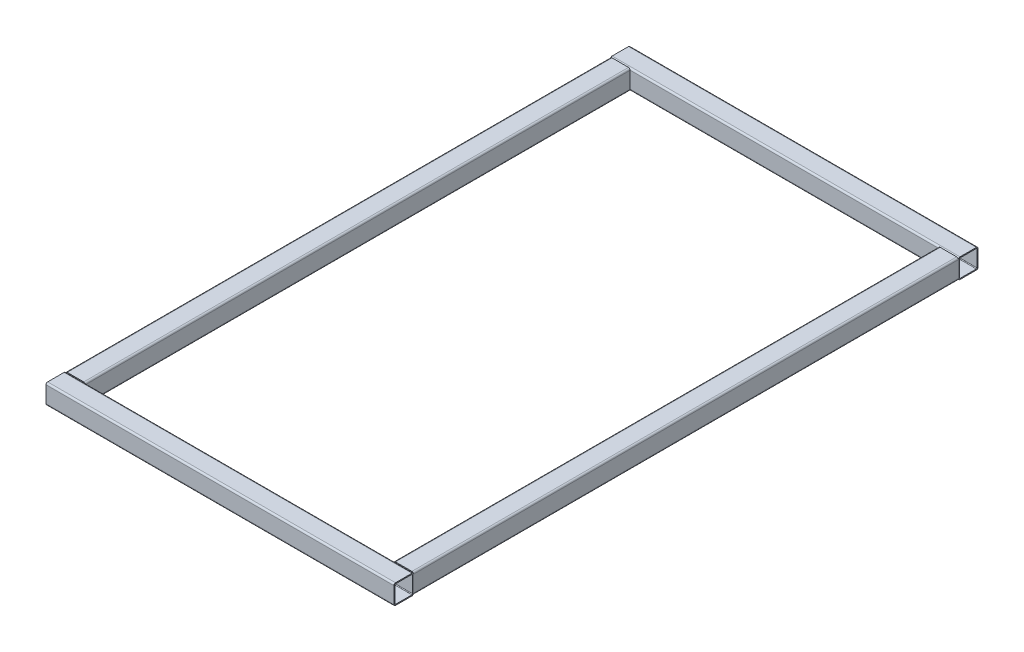
from build123d import *

# Parameters (mm, degrees)
F_120_X_80_X_8_1_DEPTH      = 1030
F_120_X_80_X_8_1_DEPTH_BACK = 30
F_120_X_80_X_8_1_2_DEPTH    = 1060
F_120_X_80_X_8_1_3_DEPTH    = 1722
F_120_X_80_X_8_1_4_DEPTH    = 1722


with BuildPart() as part:
    # Sketch1 → Прямоугольная труба 120 X 80 X 8(1) (new, two sides: drawn at the far end of the back side and taken through both)
    with BuildSketch(Plane(origin=(500, 448, 1720), x_dir=(0, -1, 0), z_dir=(-1, 0, 0)).offset(-F_120_X_80_X_8_1_DEPTH_BACK)):
        with BuildLine():
            Line((-25, -30), (25, -30))
            ThreePointArc((25, -30), (28.535533906, -28.535533906), (30, -25))
            Line((30, -25), (30, 25))
            ThreePointArc((30, 25), (28.535533906, 28.535533906), (25, 30))
            Line((25, 30), (-25, 30))
            ThreePointArc((-25, 30), (-28.535533906, 28.535533906), (-30, 25))
            Line((-30, 25), (-30, -25))
            ThreePointArc((-30, -25), (-28.535533906, -28.535533906), (-25, -30))
        make_face()
        with BuildLine():
            Line((-25, -27), (25, -27))
            ThreePointArc((25, -27), (26.414213562, -26.414213562), (27, -25))
            Line((27, -25), (27, 25))
            ThreePointArc((27, 25), (26.414213562, 26.414213562), (25, 27))
            Line((25, 27), (-25, 27))
            ThreePointArc((-25, 27), (-26.414213562, 26.414213562), (-27, 25))
            Line((-27, 25), (-27, -25))
            ThreePointArc((-27, -25), (-26.414213562, -26.414213562), (-25, -27))
        make_face(mode=Mode.SUBTRACT)
    extrude(amount=F_120_X_80_X_8_1_DEPTH + F_120_X_80_X_8_1_DEPTH_BACK)


with BuildPart() as body_2:
    # Sketch1 on segment 2 (carried to segment 2) → 120 X 80 X 8_1 2 (new body)
    with BuildSketch(Plane(origin=(530, 448, 0), x_dir=(0, -1, 0), z_dir=(-1, 0, 0))):
        with BuildLine():
            Line((-25, -30), (25, -30))
            ThreePointArc((25, -30), (28.535533906, -28.535533906), (30, -25))
            Line((30, -25), (30, 25))
            ThreePointArc((30, 25), (28.535533906, 28.535533906), (25, 30))
            Line((25, 30), (-25, 30))
            ThreePointArc((-25, 30), (-28.535533906, 28.535533906), (-30, 25))
            Line((-30, 25), (-30, -25))
            ThreePointArc((-30, -25), (-28.535533906, -28.535533906), (-25, -30))
        make_face()
        with BuildLine():
            Line((-25, -27), (25, -27))
            ThreePointArc((25, -27), (26.414213562, -26.414213562), (27, -25))
            Line((27, -25), (27, 25))
            ThreePointArc((27, 25), (26.414213562, 26.414213562), (25, 27))
            Line((25, 27), (-25, 27))
            ThreePointArc((-25, 27), (-26.414213562, 26.414213562), (-27, 25))
            Line((-27, 25), (-27, -25))
            ThreePointArc((-27, -25), (-26.414213562, -26.414213562), (-25, -27))
        make_face(mode=Mode.SUBTRACT)
    extrude(amount=F_120_X_80_X_8_1_2_DEPTH)


with BuildPart() as body_3:
    # Sketch1 on segment 3 (carried to segment 3) → 120 X 80 X 8_1 3 (new body)
    with BuildSketch(Plane(origin=(-500, 448, -1), x_dir=(0, -1, 0), z_dir=(0, 0, 1))):
        with BuildLine():
            Line((-25, -30), (25, -30))
            ThreePointArc((25, -30), (28.535533906, -28.535533906), (30, -25))
            Line((30, -25), (30, 25))
            ThreePointArc((30, 25), (28.535533906, 28.535533906), (25, 30))
            Line((25, 30), (-25, 30))
            ThreePointArc((-25, 30), (-28.535533906, 28.535533906), (-30, 25))
            Line((-30, 25), (-30, -25))
            ThreePointArc((-30, -25), (-28.535533906, -28.535533906), (-25, -30))
        make_face()
        with BuildLine():
            Line((-25, -27), (25, -27))
            ThreePointArc((25, -27), (26.414213562, -26.414213562), (27, -25))
            Line((27, -25), (27, 25))
            ThreePointArc((27, 25), (26.414213562, 26.414213562), (25, 27))
            Line((25, 27), (-25, 27))
            ThreePointArc((-25, 27), (-26.414213562, 26.414213562), (-27, 25))
            Line((-27, 25), (-27, -25))
            ThreePointArc((-27, -25), (-26.414213562, -26.414213562), (-25, -27))
        make_face(mode=Mode.SUBTRACT)
    extrude(amount=F_120_X_80_X_8_1_3_DEPTH)

    # 120 X 80 X 8_1 3 end butt 1
    split(bisect_by=Plane(origin=(-500, 448, 30), x_dir=(0, -1, 0), z_dir=(0, 0, 1)), keep=Keep.TOP)

    # 120 X 80 X 8_1 3 end butt 2
    split(bisect_by=Plane(origin=(-500, 448, 1690), x_dir=(0, 1, 0), z_dir=(0, 0, -1)), keep=Keep.TOP)


with BuildPart() as body_4:
    # Sketch1 on segment 4 (carried to segment 4) → 120 X 80 X 8_1 4 (new body)
    with BuildSketch(Plane(origin=(500, 448, -1), x_dir=(0, -1, 0), z_dir=(0, 0, 1))):
        with BuildLine():
            Line((-25, -30), (25, -30))
            ThreePointArc((25, -30), (28.535533906, -28.535533906), (30, -25))
            Line((30, -25), (30, 25))
            ThreePointArc((30, 25), (28.535533906, 28.535533906), (25, 30))
            Line((25, 30), (-25, 30))
            ThreePointArc((-25, 30), (-28.535533906, 28.535533906), (-30, 25))
            Line((-30, 25), (-30, -25))
            ThreePointArc((-30, -25), (-28.535533906, -28.535533906), (-25, -30))
        make_face()
        with BuildLine():
            Line((-25, -27), (25, -27))
            ThreePointArc((25, -27), (26.414213562, -26.414213562), (27, -25))
            Line((27, -25), (27, 25))
            ThreePointArc((27, 25), (26.414213562, 26.414213562), (25, 27))
            Line((25, 27), (-25, 27))
            ThreePointArc((-25, 27), (-26.414213562, 26.414213562), (-27, 25))
            Line((-27, 25), (-27, -25))
            ThreePointArc((-27, -25), (-26.414213562, -26.414213562), (-25, -27))
        make_face(mode=Mode.SUBTRACT)
    extrude(amount=F_120_X_80_X_8_1_4_DEPTH)

    # 120 X 80 X 8_1 4 end butt 1
    split(bisect_by=Plane(origin=(500, 448, 30), x_dir=(0, -1, 0), z_dir=(0, 0, 1)), keep=Keep.TOP)

    # 120 X 80 X 8_1 4 end butt 2
    split(bisect_by=Plane(origin=(500, 448, 1690), x_dir=(0, 1, 0), z_dir=(0, 0, -1)), keep=Keep.TOP)


solid = Compound([part.part, body_2.part, body_3.part, body_4.part])
